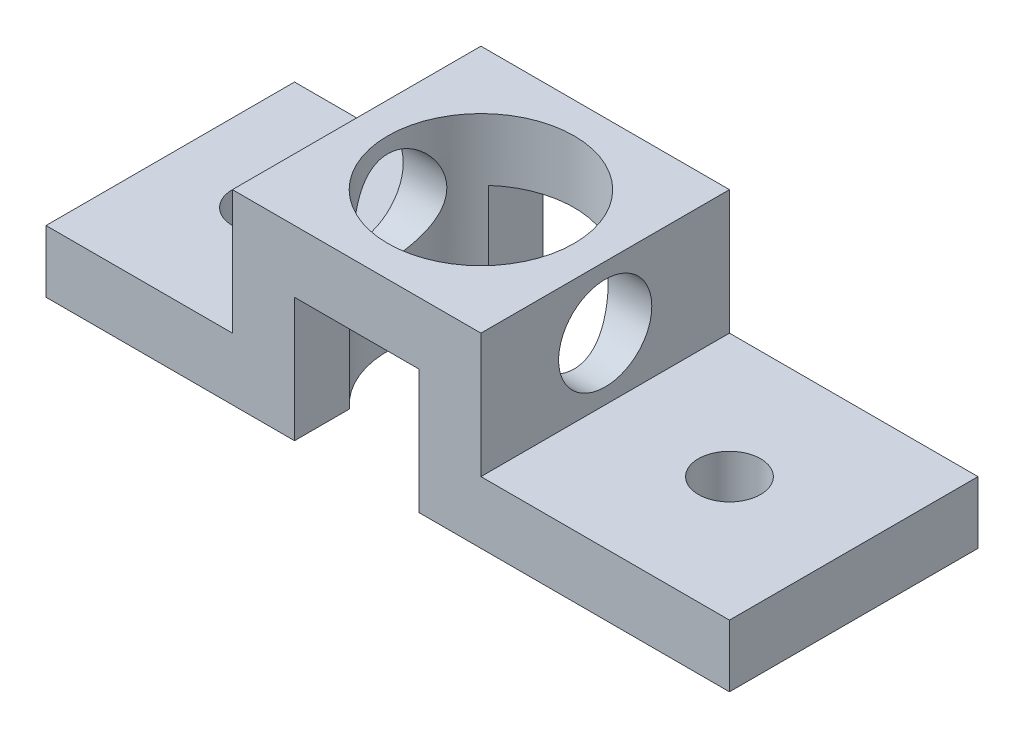
from build123d import *

# Parameters (mm, degrees)
BOSS_EXTRUDE1_DEPTH          = 25.4
F_1_2_0_75_DIAMETER_HOLE2_D  = 19.05
F_1_2_0_25_DIAMETER_HOLE1_D  = 6.35
F_1_2_0_25_DIAMETER_HOLE2_D  = 6.35
F_1_2_0_375_DIAMETER_HOLE1_D = 9.525


with BuildPart() as part:
    # Sketch1 → Boss-Extrude1 (new body)
    with BuildSketch(Plane.XY):
        Polygon((0, 0), (25.4, 0), (25.4, 12.7), (38.1, 12.7), (38.1, 0), (69.85, 0), (69.85, 6.35), (44.45, 6.35), (44.45, 19.05), (19.05, 19.05), (19.05, 6.35), (0, 6.35), align=None)
    extrude(amount=BOSS_EXTRUDE1_DEPTH)

    # 1/2 (0.75) Diameter Hole2 (through all)
    with Locations(Plane(origin=(0, 19.05, 0), x_dir=(1, 0, 0), z_dir=(0, 1, 0))):
        with Locations((31.75, -12.7)):
            Hole(F_1_2_0_75_DIAMETER_HOLE2_D / 2)

    # 1/2 (0.25) Diameter Hole1 (through all)
    with Locations(Plane(origin=(0, 6.35, 0), x_dir=(1, 0, 0), z_dir=(0, 1, 0))):
        with Locations((9.525, -12.7)):
            Hole(F_1_2_0_25_DIAMETER_HOLE1_D / 2)

    # 1/2 (0.25) Diameter Hole2 (through all)
    with Locations(Plane(origin=(0, 6.35, 0), x_dir=(1, 0, 0), z_dir=(0, 1, 0))):
        with Locations((57.15, -12.7)):
            Hole(F_1_2_0_25_DIAMETER_HOLE2_D / 2)

    # 1/2 (0.375) Diameter Hole1 (through all)
    with Locations(Plane(origin=(44.45, 0, 0), x_dir=(0, 0, -1), z_dir=(1, 0, 0))):
        with Locations((-12.7, 12.7)):
            Hole(F_1_2_0_375_DIAMETER_HOLE1_D / 2)


solid = part.part
